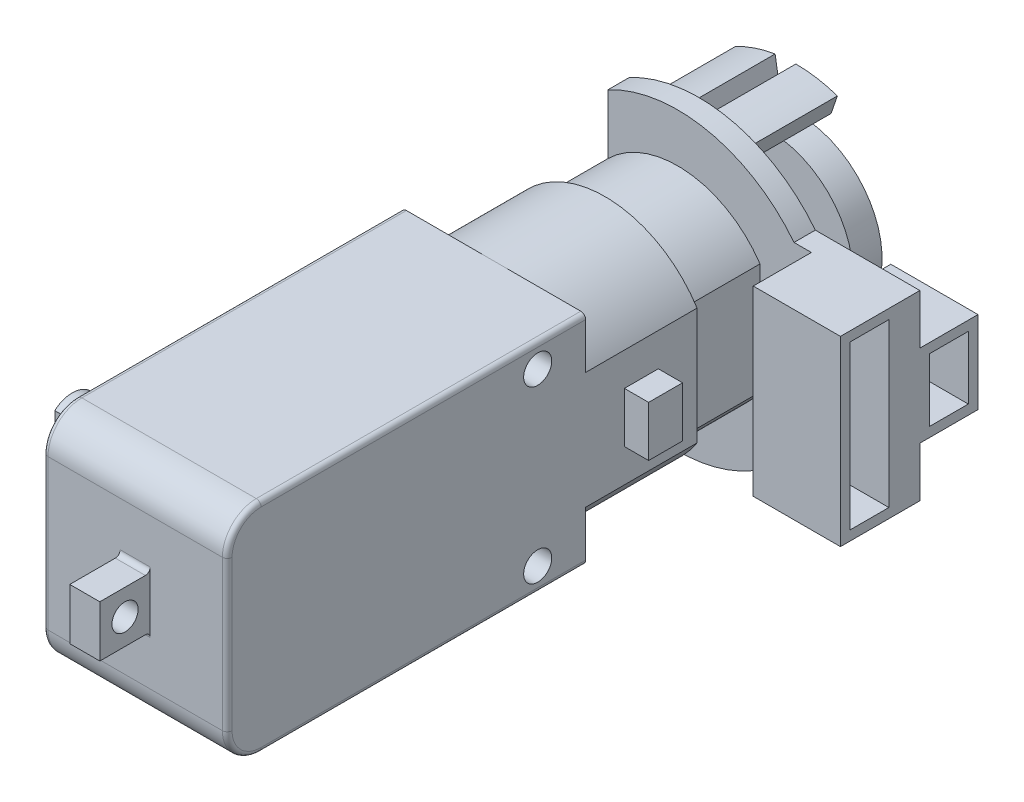
from build123d import *

# Parameters (mm, degrees)
SKETCH1_W                 = 37
SKETCH1_H                 = 22.5
BOSS_EXTRUDE1_DEPTH       = 19
SKETCH2_W                 = 3.1
SKETCH2_H                 = 5.3
BOSS_EXTRUDE2_DEPTH       = 5.2
SKETCH3_R                 = 1.35
CUT_EXTRUDE1_DEPTH        = 46.050027747
FILLET1_R                 = 3.5
SKETCH4_R                 = 3.6
BOSS_EXTRUDE3_DEPTH       = 0.1
BOSS_EXTRUDE4_START       = 0.1
SKETCH5_R                 = 3.6
BOSS_EXTRUDE4_DEPTH       = 0.1
SKETCH6_R                 = 2.7
BOSS_EXTRUDE5_DEPTH       = 8.9
BOSS_EXTRUDE6_START       = 8.9
SKETCH7_R                 = 2.7
BOSS_EXTRUDE6_DEPTH       = 8.9
FILLET2_R                 = 0.5
CUT_EXTRUDE2_START        = -8.2
CUT_EXTRUDE2_DEPTH        = 8.2
CUT_EXTRUDE3_DEPTH        = 8.2
M2X0_4_TAPPED_HOLE1_D     = 1.6
M2X0_4_TAPPED_HOLE1_DEPTH = 5.2
M2X0_4_TAPPED_HOLE1_TIP   = 0.480688495
M2X0_4_TAPPED_HOLE2_D     = 1.6
M2X0_4_TAPPED_HOLE2_DEPTH = 5.2
M2X0_4_TAPPED_HOLE2_TIP   = 0.480688495
SKETCH16_R                = 1.95
BOSS_EXTRUDE7_DEPTH       = 2
BOSS_EXTRUDE8_DEPTH       = 11.5
SKETCH18_W                = 3.5
SKETCH18_H                = 5.2
BOSS_EXTRUDE9_DEPTH       = 2.5
SKETCH19_W                = 3.5
SKETCH19_H                = 5.2
BOSS_EXTRUDE10_DEPTH      = 2.5
BOSS_EXTRUDE11_DEPTH      = 13.5
FILLET3_R                 = 1.7
BOSS_EXTRUDE12_DEPTH      = 2
SKETCH23_W                = 3.2
SKETCH23_H                = 6.5
SKETCH23_H_2              = 8.5
CUT_EXTRUDE4_DEPTH        = 6
SKETCH25_R                = 1.45
CUT_EXTRUDE5_DEPTH        = 52.878728782
FILLET4_R                 = 0.5
SKETCH26_R                = 1
BOSS_EXTRUDE13_DEPTH      = 4.5
SKETCH28_R                = 8.6
BOSS_EXTRUDE14_DEPTH      = 3
BOSS_EXTRUDE20_DEPTH      = 2.2
SKETCH30_W                = 9
SKETCH30_H                = 18.8
BOSS_EXTRUDE21_DEPTH      = 6
SKETCH31_W                = 9
SKETCH31_H                = 8.5
BOSS_EXTRUDE22_DEPTH      = 6
SKETCH32_W                = 4
SKETCH32_H                = 16.8
SKETCH32_H_2              = 6.5
CUT_EXTRUDE6_DEPTH        = 6
BOSS_EXTRUDE23_DEPTH      = 10
SKETCH34_R                = 7.497186922
CUT_EXTRUDE7_DEPTH        = 33


with BuildPart() as part:
    # Sketch1 → Boss-Extrude1 (new body)
    with BuildSketch(Plane(origin=(0, 0, 0), x_dir=(0, 0, -1), z_dir=(1, 0, 0))):
        with Locations((-18.5, 0)):
            Rectangle(SKETCH1_W, SKETCH1_H)
    extrude(amount=BOSS_EXTRUDE1_DEPTH)

    # Sketch2 → Boss-Extrude2 (add)
    with BuildSketch(Plane.XY.offset(37)):
        with Locations((9.5, 0)):
            Rectangle(SKETCH2_W, SKETCH2_H)
    extrude(amount=BOSS_EXTRUDE2_DEPTH)

    # Sketch3 → Cut-Extrude1 (cut, through all)
    with BuildSketch(Plane(origin=(11.05, 0, 0), x_dir=(0, 0, -1), z_dir=(1, 0, 0))):
        with Locations((-39.6, 0)):
            Circle(SKETCH3_R)
    extrude(amount=-CUT_EXTRUDE1_DEPTH, mode=Mode.SUBTRACT)

    # Fillet1
    fillet1_edges = [part.edges().sort_by_distance(p)[0] for p in [
        (9.5, -11.25, 37),
        (9.5, 11.25, 37),
    ]]
    fillet(fillet1_edges, radius=FILLET1_R)

    # Sketch4 → Boss-Extrude3 (add)
    with BuildSketch(Plane(origin=(19, 0, 0), x_dir=(0, 0, -1), z_dir=(1, 0, 0))):
        with Locations(Location((-25, 0, 0), (0, 0, 180))):
            Circle(SKETCH4_R)
    extrude(amount=BOSS_EXTRUDE3_DEPTH)

    # Sketch5 → Boss-Extrude4 (add)
    with BuildSketch(Plane.ZY.offset(BOSS_EXTRUDE4_START)):
        with Locations((25, 0)):
            Circle(SKETCH5_R)
    extrude(amount=-BOSS_EXTRUDE4_DEPTH)

    # Sketch6 → Boss-Extrude5 (add)
    with BuildSketch(Plane(origin=(19.1, 0, 0), x_dir=(0, 0, -1), z_dir=(1, 0, 0))):
        with Locations((-25, 0)):
            Circle(SKETCH6_R)
    extrude(amount=BOSS_EXTRUDE5_DEPTH)

    # Sketch7 → Boss-Extrude6 (add)
    with BuildSketch(Plane.ZY.offset(0.1).offset(BOSS_EXTRUDE6_START)):
        with Locations(Location((25, 0, 0), (0, 0, 180))):
            Circle(SKETCH7_R)
    extrude(amount=-BOSS_EXTRUDE6_DEPTH)

    # Fillet2
    fillet2_edges = [part.edges().sort_by_distance(p)[0] for p in [
        (9.5, 2.65, 37),
        (9.5, -2.65, 37),
    ]]
    fillet(fillet2_edges, radius=FILLET2_R)

    # Sketch8 → Cut-Extrude2 (cut)
    with BuildSketch(Plane(origin=(28, 0, 0), x_dir=(0, 0, -1), z_dir=(1, 0, 0)).offset(CUT_EXTRUDE2_START)):
        with BuildLine():
            Line((-26.8, -2.01246118), (-26.8, 2.01246118))
            ThreePointArc((-26.8, 2.01246118), (-27.7, 0), (-26.8, -2.01246118))
        make_face()
        with BuildLine():
            ThreePointArc((-22.3, 0), (-22.535248491, 1.102270384), (-23.2, 2.01246118))
            Line((-23.2, 2.01246118), (-23.2, -2.01246118))
            ThreePointArc((-23.2, -2.01246118), (-22.535248491, -1.102270384), (-22.3, 0))
        make_face()
    extrude(amount=CUT_EXTRUDE2_DEPTH, mode=Mode.SUBTRACT)

    # Sketch9 → Cut-Extrude3 (cut)
    with BuildSketch(Plane.ZY.offset(9)):
        with BuildLine():
            Line((23.2, -2.01246118), (23.2, 2.01246118))
            ThreePointArc((23.2, 2.01246118), (22.3, 0), (23.2, -2.01246118))
        make_face()
        with BuildLine():
            ThreePointArc((27.7, 0), (27.464751509, 1.102270384), (26.8, 2.01246118))
            Line((26.8, 2.01246118), (26.8, -2.01246118))
            ThreePointArc((26.8, -2.01246118), (27.464751509, -1.102270384), (27.7, 0))
        make_face()
    extrude(amount=-CUT_EXTRUDE3_DEPTH, mode=Mode.SUBTRACT)

    # M2x0.4 Tapped Hole1
    with Locations(Plane(origin=(28, 0, 0), x_dir=(0, 0, -1), z_dir=(1, 0, 0))):
        with Locations((-25, 0)):
            Hole(M2X0_4_TAPPED_HOLE1_D / 2, depth=M2X0_4_TAPPED_HOLE1_DEPTH)
            with Locations((0, 0, -(M2X0_4_TAPPED_HOLE1_DEPTH + M2X0_4_TAPPED_HOLE1_TIP / 2))):  # 118° drill point
                Cone(0, M2X0_4_TAPPED_HOLE1_D / 2, M2X0_4_TAPPED_HOLE1_TIP, mode=Mode.SUBTRACT)

    # M2x0.4 Tapped Hole2
    with Locations(Plane.ZY.offset(9)):
        with Locations((25, 0)):
            Hole(M2X0_4_TAPPED_HOLE2_D / 2, depth=M2X0_4_TAPPED_HOLE2_DEPTH)
            with Locations((0, 0, -(M2X0_4_TAPPED_HOLE2_DEPTH + M2X0_4_TAPPED_HOLE2_TIP / 2))):  # 118° drill point
                Cone(0, M2X0_4_TAPPED_HOLE2_D / 2, M2X0_4_TAPPED_HOLE2_TIP, mode=Mode.SUBTRACT)

    # Sketch16 → Boss-Extrude7 (add)
    with BuildSketch(Plane.ZY):
        with Locations((13.75, 0)):
            Circle(SKETCH16_R)
    extrude(amount=BOSS_EXTRUDE7_DEPTH)

    # Sketch17 → Boss-Extrude8 (add)
    with BuildSketch(Plane(origin=(0, 0, 0), x_dir=(-1, 0, 0), z_dir=(0, 0, -1))):
        with BuildLine():
            Line((-19, 6.025985397), (-19, -6.025985397))
            ThreePointArc((-19, -6.025985397), (-10.560588754, -11.199895156), (-1.3, -7.7021101))
            Line((-1.3, -7.7021101), (-1.3, 7.7021101))
            ThreePointArc((-1.3, 7.7021101), (-10.560588754, 11.199895156), (-19, 6.025985397))
        make_face()
    extrude(amount=BOSS_EXTRUDE8_DEPTH)

    # Sketch18 → Boss-Extrude9 (add)
    with BuildSketch(Plane(origin=(19, 0, 0), x_dir=(0, 0, -1), z_dir=(1, 0, 0))):
        with Locations((5.75, 0)):
            Rectangle(SKETCH18_W, SKETCH18_H)
    extrude(amount=BOSS_EXTRUDE9_DEPTH)

    # Sketch19 → Boss-Extrude10 (add)
    with BuildSketch(Plane.ZY.offset(-1.3)):
        with Locations((-5.75, 0)):
            Rectangle(SKETCH19_W, SKETCH19_H)
    extrude(amount=BOSS_EXTRUDE10_DEPTH)

    # Sketch20 → Boss-Extrude11 (add)
    with BuildSketch(Plane(origin=(0, 0, -11.5), x_dir=(-1, 0, 0), z_dir=(0, 0, -1))):
        with BuildLine():
            Line((-18, 5.728219619), (-18, -5.728219619))
            ThreePointArc((-18, -5.728219619), (-10.518083587, -10.199313987), (-2.3, -7.295375247))
            Line((-2.3, -7.295375247), (-2.3, 7.295375247))
            ThreePointArc((-2.3, 7.295375247), (-10.518083587, 10.199313987), (-18, 5.728219619))
        make_face()
    extrude(amount=BOSS_EXTRUDE11_DEPTH)

    # Fillet3
    fillet3_edges = [part.edges().sort_by_distance(p)[0] for p in [
        (10.518083587, 10.199313987, -25),
        (10.518083587, -10.199313987, -25),
    ]]
    fillet(fillet3_edges, radius=FILLET3_R)

    # Sketch21 → Boss-Extrude12 (add)
    with BuildSketch(Plane(origin=(0, 0, -25), x_dir=(-1, 0, 0), z_dir=(0, 0, -1))):
        with BuildLine():
            Line((-5.5, -3), (-5.5, 3))
            ThreePointArc((-5.5, 3), (-14.5, 0), (-5.5, -3))
        make_face()
    extrude(amount=BOSS_EXTRUDE12_DEPTH)

    # Sketch23 → Cut-Extrude4 (cut)
    with BuildSketch(Plane(origin=(0, 0, -25), x_dir=(-1, 0, 0), z_dir=(0, 0, -1))):
        with Locations((-9.5, 10.25)):
            Rectangle(SKETCH23_W, SKETCH23_H)
        with Locations((-9.5, -11.25)):
            Rectangle(SKETCH23_W, SKETCH23_H_2)
    extrude(amount=-CUT_EXTRUDE4_DEPTH, mode=Mode.SUBTRACT)

    # Sketch25 → Cut-Extrude5 (cut, through all)
    with BuildSketch(Plane(origin=(19, 0, 0), x_dir=(0, 0, -1), z_dir=(1, 0, 0))):
        with Locations((-4.95, 8.8)):
            Circle(SKETCH25_R)
        with Locations((-4.95, -8.8)):
            Circle(SKETCH25_R)
    extrude(amount=-CUT_EXTRUDE5_DEPTH, mode=Mode.SUBTRACT)

    # Fillet4
    fillet4_edges = [part.edges().sort_by_distance(p)[0] for p in [
        (0, -11.25, 16.75),
        (0, -10.224873734, 35.974873734),
        (0, 0, 37),
        (0, 10.224873734, 35.974873734),
        (19, -11.25, 16.75),
        (19, -10.224873734, 35.974873734),
        (19, 0, 37),
        (19, 10.224873734, 35.974873734),
        (0, 11.25, 16.75),
        (19, 11.25, 16.75),
    ]]
    fillet(fillet4_edges, radius=FILLET4_R)

    # Sketch26 → Boss-Extrude13 (add)
    with BuildSketch(Plane(origin=(0, 0, -27), x_dir=(-1, 0, 0), z_dir=(0, 0, -1))):
        with Locations((-9.5, 0)):
            Circle(SKETCH26_R)
    extrude(amount=BOSS_EXTRUDE13_DEPTH)

    # Sketch28 → Boss-Extrude14 (add)
    with BuildSketch(Plane(origin=(0, 0, -31.5), x_dir=(-1, 0, 0), z_dir=(0, 0, -1))):
        with Locations((-9.5, 0)):
            Circle(SKETCH28_R)
    extrude(amount=-BOSS_EXTRUDE14_DEPTH)

    # Sketch29 → Boss-Extrude20 (add)
    with BuildSketch(Plane(origin=(0, 0, -19), x_dir=(-1, 0, 0), z_dir=(0, 0, -1))):
        with BuildLine():
            Line((-18, -5.728219619), (-18, 5.728219619))
            ThreePointArc((-18, 5.728219619), (-15.00763058, 8.644565078), (-11.1, 10.124351831))
            ThreePointArc((-11.1, 10.124351831), (-9.5, 10.25), (-7.9, 10.124351831))
            ThreePointArc((-7.9, 10.124351831), (-4.878227923, 9.148864567), (-2.3, 7.295375247))
            Line((-2.3, 7.295375247), (-2.3, 13.443306885))
            ThreePointArc((-2.3, 13.443306885), (-12.64123277, 14.922974123), (-21.508434536, 9.4))
            Line((-21.508434536, 9.4), (-21.508434536, -9.4))
            ThreePointArc((-21.508434536, -9.4), (-12.64123277, -14.922974123), (-2.3, -13.443306885))
            Line((-2.3, -13.443306885), (-2.3, -7.295375247))
            ThreePointArc((-2.3, -7.295375247), (-4.878227923, -9.148864567), (-7.9, -10.124351831))
            ThreePointArc((-7.9, -10.124351831), (-9.5, -10.25), (-11.1, -10.124351831))
            ThreePointArc((-11.1, -10.124351831), (-15.00763058, -8.644565078), (-18, -5.728219619))
        make_face()
        with BuildLine():
            Line((-11.1, -9.26165505), (-11.1, -10.124351831))
            ThreePointArc((-11.1, -10.124351831), (-9.5, -10.25), (-7.9, -10.124351831))
            Line((-7.9, -10.124351831), (-7.9, -9.26165505))
            ThreePointArc((-7.9, -9.26165505), (-9.5, -8.799370558), (-11.1, -9.26165505))
        make_face()
        with BuildLine():
            ThreePointArc((-7.9, 10.124351831), (-9.5, 10.25), (-11.1, 10.124351831))
            Line((-11.1, 10.124351831), (-11.1, 9.26165505))
            ThreePointArc((-11.1, 9.26165505), (-9.5, 8.799370558), (-7.9, 9.26165505))
            Line((-7.9, 9.26165505), (-7.9, 10.124351831))
        make_face()
        with BuildLine():
            ThreePointArc((-23, 7.09313048), (-22.30626682, 8.280219208), (-21.508434536, 9.4))
            Line((-21.508434536, 9.4), (-32.3, 9.4))
            Line((-32.3, 9.4), (-32.3, -9.4))
            Line((-32.3, -9.4), (-21.508434536, -9.4))
            ThreePointArc((-21.508434536, -9.4), (-22.30626682, -8.280219208), (-23, -7.09313048))
            Line((-23, -7.09313048), (-23, 7.09313048))
        make_face()
        with BuildLine():
            Line((-21.508434536, -9.4), (-21.508434536, 9.4))
            ThreePointArc((-21.508434536, 9.4), (-22.30626682, 8.280219208), (-23, 7.09313048))
            Line((-23, 7.09313048), (-23, -7.09313048))
            ThreePointArc((-23, -7.09313048), (-22.30626682, -8.280219208), (-21.508434536, -9.4))
        make_face()
    extrude(amount=BOSS_EXTRUDE20_DEPTH)

    # Sketch30 → Boss-Extrude21 (add)
    with BuildSketch(Plane.XY.offset(-19)):
        with Locations((27.8, 0)):
            Rectangle(SKETCH30_W, SKETCH30_H)
    extrude(amount=BOSS_EXTRUDE21_DEPTH)

    # Sketch31 → Boss-Extrude22 (add)
    with BuildSketch(Plane(origin=(0, 0, -21.2), x_dir=(-1, 0, 0), z_dir=(0, 0, -1))):
        with Locations((-27.8, 0)):
            Rectangle(SKETCH31_W, SKETCH31_H)
    extrude(amount=BOSS_EXTRUDE22_DEPTH)

    # Sketch32 → Cut-Extrude6 (cut)
    with BuildSketch(Plane(origin=(32.3, 0, 0), x_dir=(0, 0, -1), z_dir=(1, 0, 0))):
        with Locations((16, 0)):
            Rectangle(SKETCH32_W, SKETCH32_H)
        with Locations((24.2, 0)):
            Rectangle(SKETCH32_W, SKETCH32_H_2)
    extrude(amount=-CUT_EXTRUDE6_DEPTH, mode=Mode.SUBTRACT)

    # Sketch33 → Boss-Extrude23 (add)
    with BuildSketch(Plane(origin=(0, 0, -21.2), x_dir=(-1, 0, 0), z_dir=(0, 0, -1))):
        with BuildLine():
            Line((-9.5, 11.25), (-9.5, 13.25))
            ThreePointArc((-9.5, 13.25), (-11.672131148, 13.070743907), (-13.785489806, 12.537825853))
            Line((-13.785489806, 12.537825853), (-13.13862342, 10.645323838))
            ThreePointArc((-13.13862342, 10.645323838), (-11.344262295, 11.09780143), (-9.5, 11.25))
        make_face()
        with BuildLine():
            Line((-4.18852459, 9.917193604), (-3.244262295, 11.680250244))
            ThreePointArc((-3.244262295, 11.680250244), (-5.243689802, 12.547761693), (-7.358282522, 13.075761785))
            Line((-7.358282522, 13.075761785), (-7.681560632, 11.102061893))
            ThreePointArc((-7.681560632, 11.102061893), (-5.886151719, 10.653759928), (-4.18852459, 9.917193604))
        make_face()
        with BuildLine():
            Line((-9.5, -13.25), (-9.5, -11.25))
            ThreePointArc((-9.5, -11.25), (-11.344262295, -11.09780143), (-13.13862342, -10.645323838))
            Line((-13.13862342, -10.645323838), (-13.785489806, -12.537825853))
            ThreePointArc((-13.785489806, -12.537825853), (-11.672131148, -13.070743907), (-9.5, -13.25))
        make_face()
        with BuildLine():
            ThreePointArc((-7.358282522, -13.075761785), (-5.243689802, -12.547761693), (-3.244262295, -11.680250244))
            Line((-3.244262295, -11.680250244), (-4.18852459, -9.917193604))
            ThreePointArc((-4.18852459, -9.917193604), (-5.886151719, -10.653759928), (-7.681560632, -11.102061893))
            Line((-7.681560632, -11.102061893), (-7.358282522, -13.075761785))
        make_face()
    extrude(amount=BOSS_EXTRUDE23_DEPTH)

    # Sketch34 → Cut-Extrude7 (cut)
    with BuildSketch(Plane(origin=(19, 0, 0), x_dir=(0, 0, -1), z_dir=(1, 0, 0))):
        with Locations((-25, 0)):
            Circle(SKETCH34_R)
    extrude(amount=CUT_EXTRUDE7_DEPTH, mode=Mode.SUBTRACT)


solid = part.part
